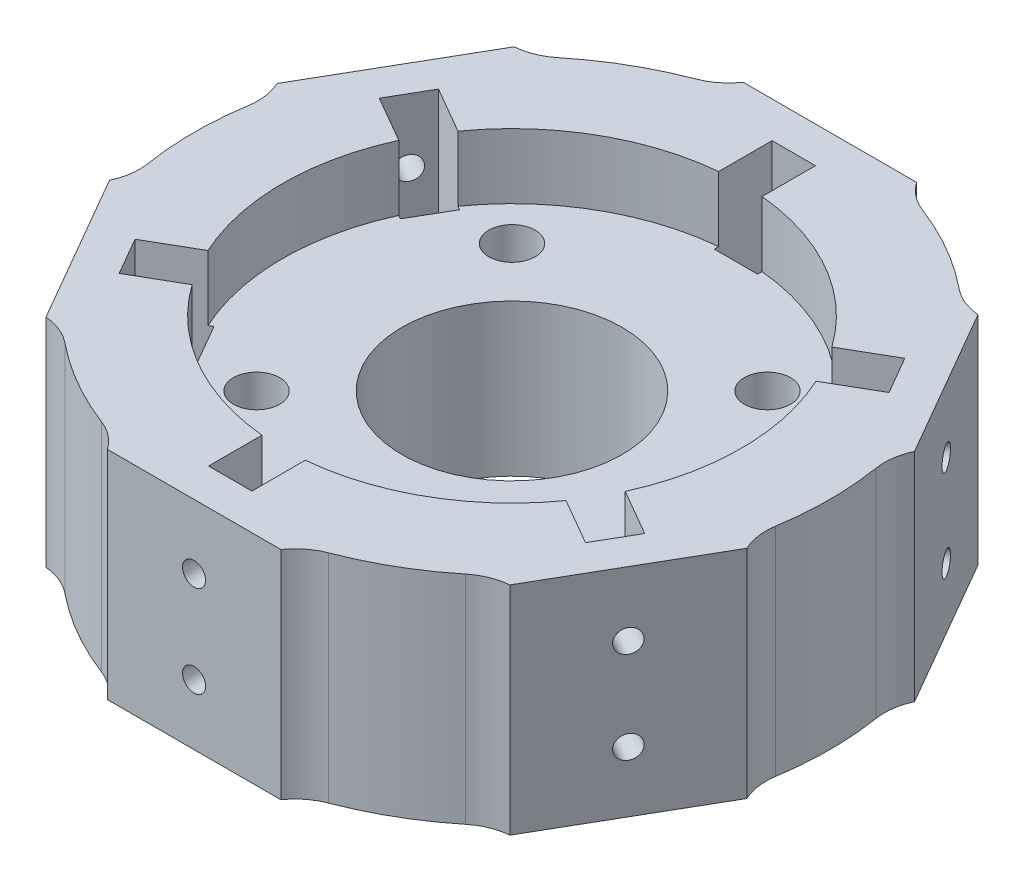
from build123d import *

# Parameters (mm, degrees)
BOSS_EXTRUDE1_DEPTH                          = 30
M3_CLEARANCE_HOLE_PLASTIC_PARTS_ONLY_A_COUNT = 2
M3_CLEARANCE_HOLE_PLASTIC_PARTS_ONLY_A_PITCH = 12.7
WRENCH_START                                 = -5
SKETCH10_W                                   = 5.999999938
SKETCH10_H                                   = 30
WRENCH_CLEARANCE_SLOTS_PLASTIC_PARTS_O_DEPTH = 8
BODY_REVOLVE_PLASTIC_PARTS_ONLY_COUNT        = 6
MOUNTING_SCREWS_D                            = 6.4
MOUNTING_SCREWS_CBORE_D                      = 11
MOUNTING_SCREWS_CBORE_DEPTH                  = 6.5
LOCATING_PIN_D                               = 6.3


with BuildPart() as part:
    # Sketch2 → Boss-Extrude1 (new body)
    with BuildSketch(Plane(origin=(0, 0, 0), x_dir=(1, 0, 0), z_dir=(0, 1, 0))):
        with BuildLine():
            Line((-12, 44), (12, 44))
            ThreePointArc((12, 44), (13.635846147, 42.271481958), (15.707794494, 41.100671432))
            ThreePointArc((15.707794494, 41.100671432), (22, 38.105117767), (27.740328326, 34.153684785))
            ThreePointArc((27.740328326, 34.153684785), (29.790254158, 32.944730144), (32.105117767, 32.392304845))
            Line((32.105117767, 32.392304845), (0, 0))
            Line((0, 0), (-12, 44))
        make_face()
    boss_extrude1 = extrude(amount=-BOSS_EXTRUDE1_DEPTH)

    # Sketch9 → M3 Clearance Hole - Plastic Parts Only (revolve, cut)
    with BuildSketch(Plane(origin=(0, -8.918, -44), x_dir=(0, 1, 0), z_dir=(1, 0, 0))):
        Polygon((0, 0), (0, 10.96138239), (1.6, 10.0000054), (1.6, 0), align=None)
    m3_clearance_hole_plastic_parts_only = revolve(axis=Axis((0, -8.918, -50.35), (0, 0, 1)), mode=Mode.SUBTRACT)

    # M3 Clearance Hole - Plastic Parts Only a: M3 Clearance Hole - Plastic Parts Only ×2
    with Locations(*[(0, -i * M3_CLEARANCE_HOLE_PLASTIC_PARTS_ONLY_A_PITCH, 0) for i in range(1, M3_CLEARANCE_HOLE_PLASTIC_PARTS_ONLY_A_COUNT)]):
        add(m3_clearance_hole_plastic_parts_only, mode=Mode.SUBTRACT)

    # Sketch10 → Wrench Clearance Slots - Plastic Parts Only (cut)
    with BuildSketch(Plane(origin=(0, 0, -44), x_dir=(-1, 0, 0), z_dir=(0, 0, -1)).offset(WRENCH_START)):
        with Locations((0, -15)):
            Rectangle(SKETCH10_W, SKETCH10_H)
    wrench_clearance_slots_plastic_parts_o = extrude(amount=-WRENCH_CLEARANCE_SLOTS_PLASTIC_PARTS_O_DEPTH, mode=Mode.SUBTRACT)

    # Body Revolve - Plastic Parts Only: Boss-Extrude1, M3 Clearance Hole - Plastic Parts Only, Wrench Clearance Slots - Plastic Parts Only ×6 about axis
    body_revolve_plastic_parts_only_axis = Axis((0, 0, 0), (0, 1, 0))
    add([boss_extrude1.rotate(body_revolve_plastic_parts_only_axis, i * 360 / BODY_REVOLVE_PLASTIC_PARTS_ONLY_COUNT) for i in range(1, BODY_REVOLVE_PLASTIC_PARTS_ONLY_COUNT)])
    add([m3_clearance_hole_plastic_parts_only.rotate(body_revolve_plastic_parts_only_axis, i * 360 / BODY_REVOLVE_PLASTIC_PARTS_ONLY_COUNT) for i in range(1, BODY_REVOLVE_PLASTIC_PARTS_ONLY_COUNT)], mode=Mode.SUBTRACT)
    add([wrench_clearance_slots_plastic_parts_o.rotate(body_revolve_plastic_parts_only_axis, i * 360 / BODY_REVOLVE_PLASTIC_PARTS_ONLY_COUNT) for i in range(1, BODY_REVOLVE_PLASTIC_PARTS_ONLY_COUNT)], mode=Mode.SUBTRACT)

    # Body Revolve - Plastic Parts Only copy 1 → Body Revolve - Plastic Parts Only co 2 (revolve, cut)
    with BuildSketch(Plane(origin=(-38.105117767, -21.618, -22), x_dir=(0, 1, 0), z_dir=(0.5000000000000001, 0, -0.8660254037844386))):
        Polygon((0, 0), (0, 10.96138239), (1.6, 10.0000054), (1.6, 0), align=None)
    revolve(axis=Axis((-43.604379081, -21.618, -25.175), (0.8660254037844386, 0, 0.5000000000000001)), mode=Mode.SUBTRACT)

    # Body Revolve - Plastic Parts Only copy 2 → Body Revolve - Plastic Parts Only co 3 (revolve, cut)
    with BuildSketch(Plane(origin=(-38.105117767, -21.618, 22), x_dir=(0, 1, 0), z_dir=(-0.4999999999999998, 0, -0.8660254037844387))):
        Polygon((0, 0), (0, 10.96138239), (1.6, 10.0000054), (1.6, 0), align=None)
    revolve(axis=Axis((-43.604379081, -21.618, 25.175), (0.8660254037844387, 0, -0.4999999999999998)), mode=Mode.SUBTRACT)

    # Body Revolve - Plastic Parts Only copy 3 → Body Revolve - Plastic Parts Only co 4 (revolve, cut)
    with BuildSketch(Plane(origin=(0, -21.618, 44), x_dir=(0, 1, 0), z_dir=(-1, 0, 0))):
        Polygon((0, 0), (0, 10.96138239), (1.6, 10.0000054), (1.6, 0), align=None)
    revolve(axis=Axis((0, -21.618, 50.35), (0, 0, -1)), mode=Mode.SUBTRACT)

    # Body Revolve - Plastic Parts Only copy 4 → Body Revolve - Plastic Parts Only co 5 (revolve, cut)
    with BuildSketch(Plane(origin=(38.105117767, -21.618, 22), x_dir=(0, 1, 0), z_dir=(-0.5000000000000004, 0, 0.8660254037844384))):
        Polygon((0, 0), (0, 10.96138239), (1.6, 10.0000054), (1.6, 0), align=None)
    revolve(axis=Axis((43.604379081, -21.618, 25.175), (-0.8660254037844384, 0, -0.5000000000000004)), mode=Mode.SUBTRACT)

    # Body Revolve - Plastic Parts Only copy 5 → Body Revolve - Plastic Parts Only co 6 (revolve, cut)
    with BuildSketch(Plane(origin=(38.105117767, -21.618, -22), x_dir=(0, 1, 0), z_dir=(0.5000000000000001, 0, 0.8660254037844386))):
        Polygon((0, 0), (0, 10.96138239), (1.6, 10.0000054), (1.6, 0), align=None)
    revolve(axis=Axis((43.604379081, -21.618, -25.175), (-0.8660254037844386, 0, 0.5000000000000001)), mode=Mode.SUBTRACT)

    # Sketch3 → End of Arm Flange Clearance (revolve, cut)
    with BuildSketch(Plane.XY, mode=Mode.PRIVATE) as end_of_arm_flange_clearance_sk:
        Polygon((0, 0), (0, -30), (15.25, -30), (15.25, -9), (31.75, -9), (31.75, 0), align=None)
    revolve(end_of_arm_flange_clearance_sk.sketch.rotate(Axis((0, -948.680059029, 0), (0, 1, 0)), 90), axis=Axis((0, -948.680059029, 0), (0, 1, 0)), mode=Mode.SUBTRACT)

    # Mounting Screws (through all)
    with Locations(Plane(origin=(0, -30, 0), x_dir=(-1, 0, 0), z_dir=(0, -1, 0))):
        with Locations((-17.67766953, -17.67766953), (-17.67766953, 17.67766953), (17.67766953, 17.67766953), (17.67766953, -17.67766953)):
            CounterBoreHole(MOUNTING_SCREWS_D / 2, MOUNTING_SCREWS_CBORE_D / 2, MOUNTING_SCREWS_CBORE_DEPTH)

    # Locating Pin (through all)
    with Locations(Plane(origin=(0, -30, 0), x_dir=(-1, 0, 0), z_dir=(0, -1, 0))):
        with Locations((0, -25)):
            Hole(LOCATING_PIN_D / 2)


solid = part.part
